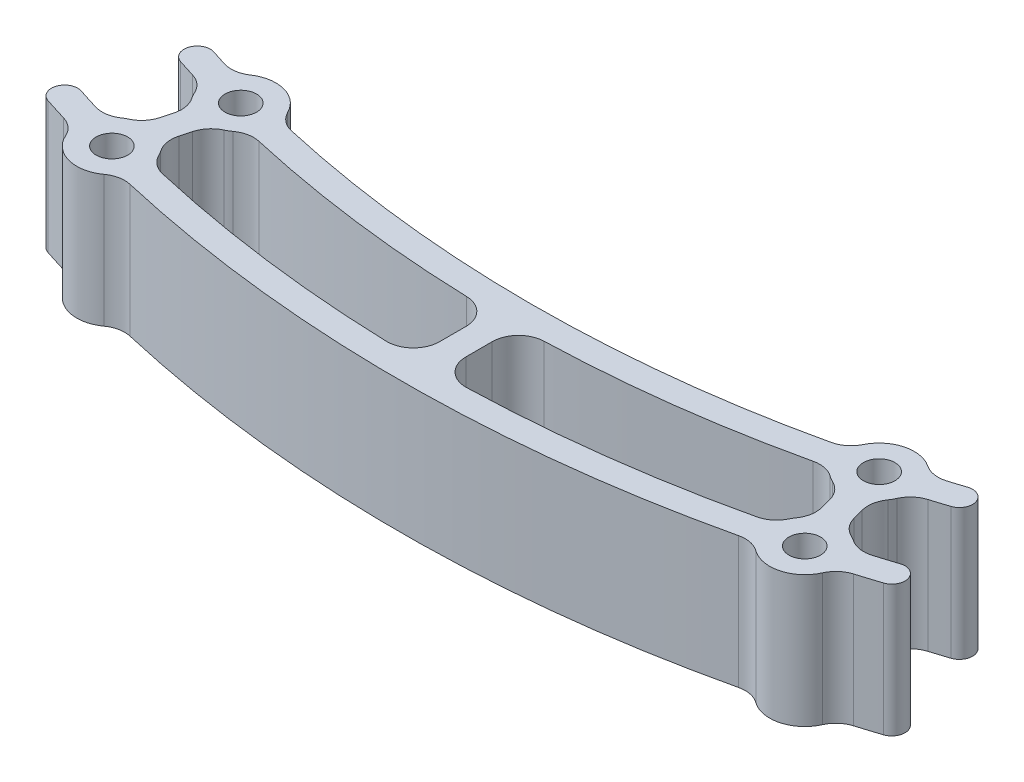
from build123d import *

# Parameters (mm, degrees)
BOSS_EXTRUDE1_DEPTH   = 15
BOSS_EXTRUDE1_2_DEPTH = 15
SKETCH3_R             = 4
BOSS_EXTRUDE2_DEPTH   = 15
SKETCH4_W             = 3
SKETCH4_H             = 12.980116284
BOSS_EXTRUDE3_DEPTH   = 15
M3_CLEARANCE_HOLE1_D  = 3.6
FILLET1_R             = 3


with BuildPart() as part:
    # Sketch2 → Boss-Extrude1 (new body)
    with BuildSketch(Plane(origin=(0, 0, 0), x_dir=(1, 0, 0), z_dir=(0, 1, 0))):
        with BuildLine():
            ThreePointArc((-43.925828926, -135.189800544), (0, -142.146968374), (43.925828926, -135.189800544))
            ThreePointArc((43.925828926, -135.189800544), (44.888888209, -133.299690278), (42.998777943, -132.336630995))
            ThreePointArc((42.998777943, -132.336630995), (0, -139.146968374), (-42.998777943, -132.336630995))
            ThreePointArc((-42.998777943, -132.336630995), (-44.888888209, -133.299690278), (-43.925828926, -135.189800544))
        make_face()
    extrude(amount=BOSS_EXTRUDE1_DEPTH)



with BuildPart() as body_2:
    # Sketch2 → Boss-Extrude1 2 (new body)
    with BuildSketch(Plane(origin=(0, 0, 0), x_dir=(1, 0, 0), z_dir=(0, 1, 0))):
        with BuildLine():
            ThreePointArc((-47.634032859, -146.602478739), (0, -154.146968374), (47.634032859, -146.602478739))
            ThreePointArc((47.634032859, -146.602478739), (48.597092142, -144.712368473), (46.706981876, -143.749309191))
            ThreePointArc((46.706981876, -143.749309191), (0, -151.146968374), (-46.706981876, -143.749309191))
            ThreePointArc((-46.706981876, -143.749309191), (-48.597092142, -144.712368473), (-47.634032859, -146.602478739))
        make_face()
    extrude(amount=BOSS_EXTRUDE1_2_DEPTH)


with BuildPart() as part_1:
    add(part.part)

    add(body_2.part)  # Boss-Extrude2 merges body 2
    # Sketch3 → Boss-Extrude2 (add)
    with BuildSketch(Plane(origin=(0, 0, 0), x_dir=(1, 0, 0), z_dir=(0, 1, 0))):
        with Locations((-36.402114051, -135.854539142)):
            Circle(SKETCH3_R)
        with Locations((-39.507942592, -147.445649057)):
            Circle(SKETCH3_R)
        with Locations((36.402114051, -135.854539142)):
            Circle(SKETCH3_R)
        with Locations((39.507942592, -147.445649057)):
            Circle(SKETCH3_R)
    extrude(amount=BOSS_EXTRUDE2_DEPTH)

    # Sketch4 → Boss-Extrude3 (add)
    with BuildSketch(Plane(origin=(0, 0, 0), x_dir=(1, 0, 0), z_dir=(0, 1, 0))):
        Polygon((-37.72416641, -134.992950759), (-34.826388931, -135.769407894), (-38.185890233, -148.307237441), (-41.083667712, -147.530780305), align=None)
        Polygon((37.72416641, -134.992950759), (34.826388931, -135.769407894), (38.185890233, -148.307237441), (41.083667712, -147.530780305), align=None)
        with Locations((0, -146.646968374)):
            Rectangle(SKETCH4_W, SKETCH4_H)
    extrude(amount=BOSS_EXTRUDE3_DEPTH)

    # M3 Clearance Hole1 (through all)
    with Locations(Plane(origin=(0, 15, 0), x_dir=(1, 0, 0), z_dir=(0, 1, 0))):
        with Locations((-36.402114051, -135.854539142), (-39.507942592, -147.445649057), (39.507942592, -147.445649057), (36.402114051, -135.854539142)):
            Hole(M3_CLEARANCE_HOLE1_D / 2)

    # Fillet1
    fillet1_edges = [part_1.edges().sort_by_distance(p)[0] for p in [
        (37.099327148, 7.5, 144.252128799),
        (39.997104626, 7.5, 143.475671664),
        (38.810729496, 7.5, 139.0480594),
        (35.912952017, 7.5, 139.824516535),
        (1.5, 7.5, 151.139525104),
        (-1.5, 7.5, 151.139525104),
        (-1.5, 7.5, 142.13905381),
        (1.5, 7.5, 142.13905381),
        (-40.378179495, 7.5, 136.291464291),
        (-33.177202944, 7.5, 138.220960143),
        (-39.563519144, 7.5, 133.403923333),
        (-32.438949025, 7.5, 135.312946143),
        (33.177202944, 7.5, 138.220960143),
        (40.378179495, 7.5, 136.291464291),
        (32.438949025, 7.5, 135.312946143),
        (39.563519144, 7.5, 133.403923333),
        (-35.912952017, 7.5, 139.824516535),
        (-38.810729496, 7.5, 139.0480594),
        (-37.099327148, 7.5, 144.252128799),
        (-39.997104626, 7.5, 143.475671664),
        (-42.671898851, 7.5, 144.998327911),
        (-35.544215523, 7.5, 146.908184903),
        (-43.483555405, 7.5, 147.886673735),
        (-36.28547324, 7.5, 149.815394038),
        (35.544215523, 7.5, 146.908184903),
        (42.671898851, 7.5, 144.998327911),
        (36.28547324, 7.5, 149.815394038),
        (43.483555405, 7.5, 147.886673735),
    ]]
    fillet(fillet1_edges, radius=FILLET1_R)


solid = part_1.part
